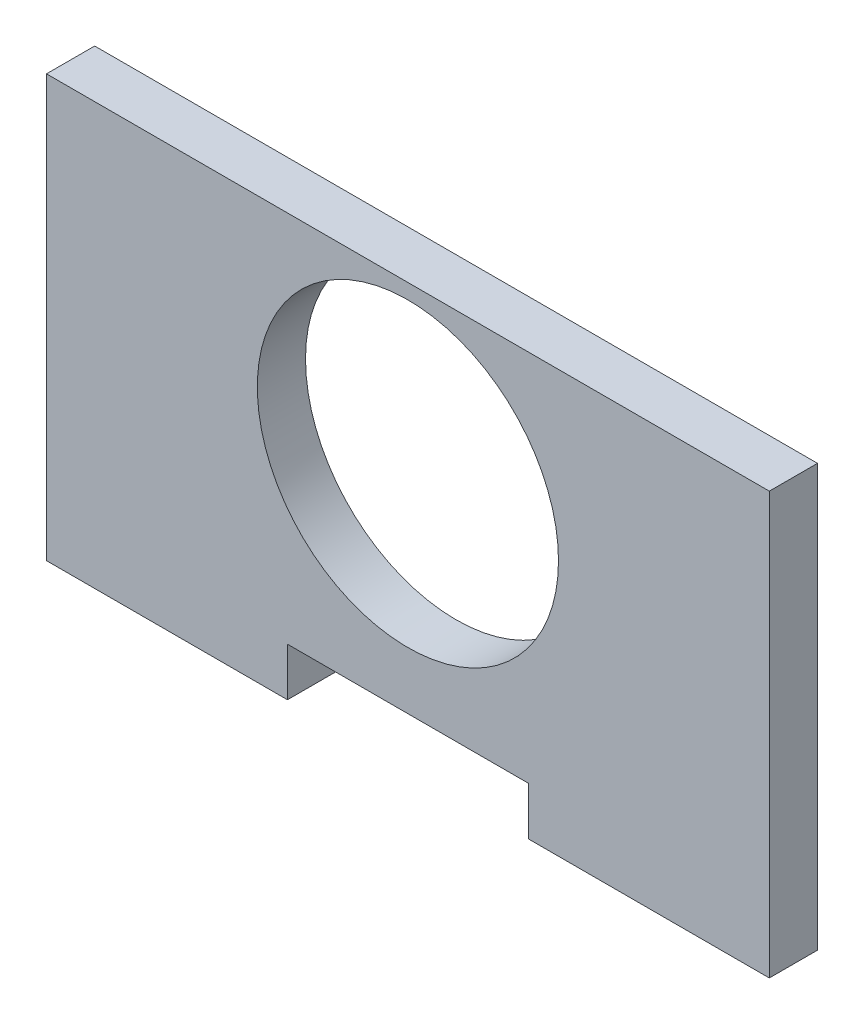
from build123d import *

# Parameters (mm, degrees)
SKETCH1_W           = 76.2
SKETCH1_H           = 44.45
BOSS_EXTRUDE1_DEPTH = 5.08
SKETCH4_R           = 15.875
CUT_EXTRUDE2_DEPTH  = 12.7
SKETCH6_W           = 25.4
SKETCH6_H           = 5.08
CUT_EXTRUDE4_DEPTH  = 5.08


with BuildPart() as part:
    # Sketch1 → Boss-Extrude1 (new body)
    with BuildSketch(Plane.XY):
        Rectangle(SKETCH1_W, SKETCH1_H)
    extrude(amount=BOSS_EXTRUDE1_DEPTH)

    # Sketch4 → Cut-Extrude2 (cut)
    with BuildSketch(Plane.XY.offset(5.08)):
        with Locations((0, 4.7625)):
            Circle(SKETCH4_R)
    extrude(amount=-CUT_EXTRUDE2_DEPTH, mode=Mode.SUBTRACT)

    # Sketch6 → Cut-Extrude4 (cut)
    with BuildSketch(Plane.XZ.offset(22.225)):
        with Locations((0, 2.54)):
            Rectangle(SKETCH6_W, SKETCH6_H)
    extrude(amount=-CUT_EXTRUDE4_DEPTH, mode=Mode.SUBTRACT)


solid = part.part
